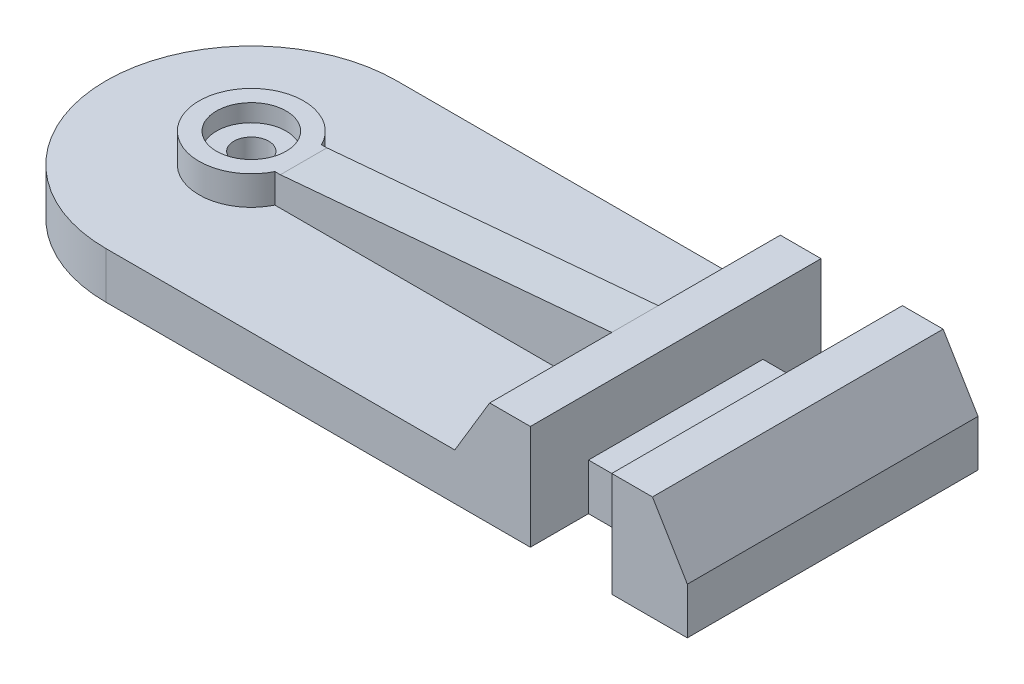
from build123d import *

# Parameters (mm, degrees)
EXTRUDE_1_DEPTH     = 4
SKETCH_2_R          = 4.5
SKETCH_2_R_2        = 3
EXTRUDE_2_DEPTH     = 2.5
EXTRUDE_3_DEPTH     = 25
SKETCH_4_W          = 7
SKETCH_4_H          = 5
CUT_EXTRUDE_1_DEPTH = 57.621550668
SKETCH_5_W          = 7
SKETCH_5_H          = 5
CUT_EXTRUDE_2_DEPTH = 52.780787943
EXTRUDE_4_DEPTH     = 2
SKETCH_7_R          = 3
SKETCH_7_R_2        = 1.5
EXTRUDE_5_DEPTH     = 1


with BuildPart() as part:
    # 草图1 → 凸台-拉伸1 (new body)
    with BuildSketch(Plane(origin=(0, 0, 0), x_dir=(1, 0, 0), z_dir=(0, 1, 0))):
        with BuildLine():
            ThreePointArc((12.5, 0), (8.838834765, 8.838834765), (0, 12.5))
            ThreePointArc((0, 12.5), (-8.838834765, 8.838834765), (-12.5, 0))
            Line((-12.5, 0), (-1.5, 0))
            ThreePointArc((-1.5, 0), (0, 1.5), (1.5, 0))
            Line((1.5, 0), (12.5, 0))
        make_face()
        with BuildLine():
            ThreePointArc((0, -12.5), (8.838834765, -8.838834765), (12.5, 0))
            Line((12.5, 0), (1.5, 0))
            ThreePointArc((1.5, 0), (0, -1.5), (-1.5, 0))
            Line((-1.5, 0), (-12.5, 0))
            ThreePointArc((-12.5, 0), (-8.838834765, -8.838834765), (0, -12.5))
        make_face()
        with BuildLine():
            Line((50, 12.5), (0, 12.5))
            ThreePointArc((0, 12.5), (8.838834765, 8.838834765), (12.5, 0))
            Line((12.5, 0), (38.5, 0))
            ThreePointArc((38.5, 0), (40, 1.5), (41.5, 0))
            Line((41.5, 0), (50, 0))
            Line((50, 0), (50, 12.5))
        make_face()
        with BuildLine():
            Line((38.5, 0), (12.5, 0))
            ThreePointArc((12.5, 0), (8.838834765, -8.838834765), (0, -12.5))
            Line((0, -12.5), (50, -12.5))
            Line((50, -12.5), (50, 0))
            Line((50, 0), (41.5, 0))
            ThreePointArc((41.5, 0), (40, -1.5), (38.5, 0))
        make_face()
    extrude(amount=EXTRUDE_1_DEPTH)

    # 草图2 → 凸台-拉伸2 (add)
    with BuildSketch(Plane(origin=(0, 4, 0), x_dir=(1, 0, 0), z_dir=(0, 1, 0))):
        with Locations(Location((0, 0, 0), (0, 0, 270))):
            Circle(SKETCH_2_R)
        with Locations(Location((0, 0, 0), (0, 0, 270))):
            Circle(SKETCH_2_R_2, mode=Mode.SUBTRACT)
    extrude(amount=EXTRUDE_2_DEPTH)

    # 草图3 → 凸台-拉伸3 (add)
    with BuildSketch(Plane.XY.offset(12.5)):
        Polygon((33, 9), (47, 9), (50, 4), (30, 4), align=None)
    extrude(amount=-EXTRUDE_3_DEPTH)

    # 草图4 → 切除-拉伸1 (cut, through all)
    with BuildSketch(Plane.XY.offset(12.5)):
        with Locations((40, 6.5)):
            Rectangle(SKETCH_4_W, SKETCH_4_H)
    extrude(amount=-CUT_EXTRUDE_1_DEPTH, mode=Mode.SUBTRACT)

    # 草图5 → 切除-拉伸2 (cut, through all)
    with BuildSketch(Plane(origin=(0, 4, 0), x_dir=(1, 0, 0), z_dir=(0, 1, 0))):
        with Locations((40, -10)):
            Rectangle(SKETCH_5_W, SKETCH_5_H)
        with Locations((40, 10)):
            Rectangle(SKETCH_5_W, SKETCH_5_H)
    extrude(amount=-CUT_EXTRUDE_2_DEPTH, mode=Mode.SUBTRACT)

    # 草图6 → 凸台-拉伸4 (add, symmetric)
    with BuildSketch(Plane.XY):
        Polygon((30, 4), (33, 9), (4.5, 6.5), (3.215772895, 6.5), (3.215772895, 4), align=None)
    extrude(amount=EXTRUDE_4_DEPTH, both=True)

    # 草图7 → 凸台-拉伸5 (add)
    with BuildSketch(Plane(origin=(0, 4, 0), x_dir=(1, 0, 0), z_dir=(0, 1, 0))):
        with Locations(Location((0, 0, 0), (0, 0, 270))):
            Circle(SKETCH_7_R)
        with Locations(Location((0, 0, 0), (0, 0, 270))):
            Circle(SKETCH_7_R_2, mode=Mode.SUBTRACT)
    extrude(amount=EXTRUDE_5_DEPTH)


solid = part.part
